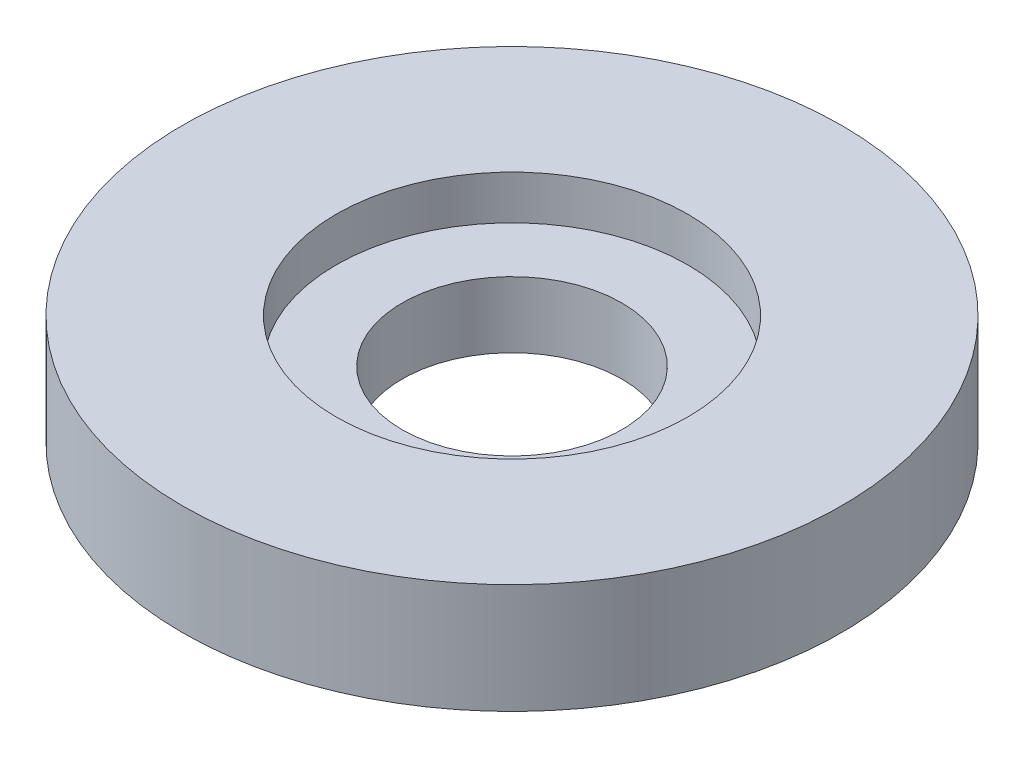
from build123d import *

# Parameters (mm, degrees)
SKETCH1_R           = 15
SKETCH1_R_2         = 5
BOSS_EXTRUDE1_DEPTH = 5
SKETCH2_R           = 8
CUT_EXTRUDE1_DEPTH  = 2


with BuildPart() as part:
    # Sketch1 → Boss-Extrude1 (new body)
    with BuildSketch(Plane(origin=(0, 0, 0), x_dir=(1, 0, 0), z_dir=(0, 1, 0))):
        with Locations(Location((0, 0, 0), (0, 0, 270))):
            Circle(SKETCH1_R)
        with Locations(Location((0, 0, 0), (0, 0, 270))):
            Circle(SKETCH1_R_2, mode=Mode.SUBTRACT)
    extrude(amount=BOSS_EXTRUDE1_DEPTH)

    # Sketch2 → Cut-Extrude1 (cut)
    with BuildSketch(Plane(origin=(0, 5, 0), x_dir=(1, 0, 0), z_dir=(0, 1, 0))):
        with Locations(Location((0, 0, 0), (0, 0, 270))):
            Circle(SKETCH2_R)
    extrude(amount=-CUT_EXTRUDE1_DEPTH, mode=Mode.SUBTRACT)


solid = part.part
